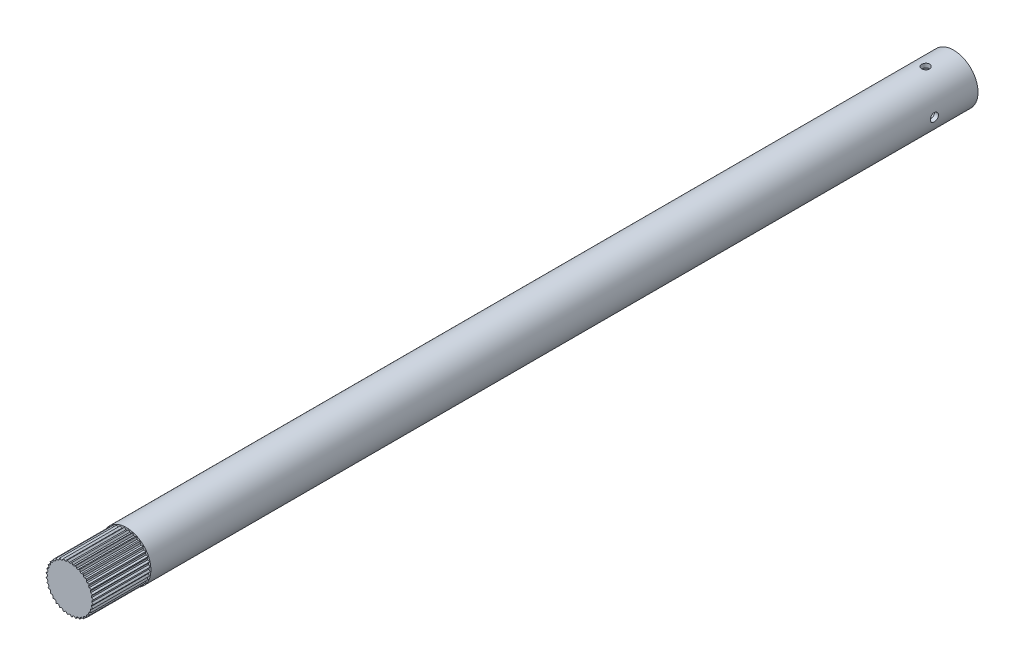
from build123d import *

# Parameters (mm, degrees)
SKETCH5_W               = 1.587499994
SKETCH5_H               = 345.340081988
CUT_EXTRUDE5_DEPTH      = 368.748370511
CUT_EXTRUDE5_DEPTH_BACK = 368.748370511
SKETCH7_R               = 1.5875
CUT_EXTRUDE6_DEPTH      = 368.748370616
CUT_EXTRUDE6_DEPTH_BACK = 368.748370616
SKETCH6_R               = 1.5875
CUT_EXTRUDE7_START      = 367.501582
SKETCH8_R               = 12.7
CUT_EXTRUDE7_DEPTH      = 22.225
SKETCH10_R              = 7.9375
BOSS_EXTRUDE1_DEPTH     = 319.940081988


with BuildPart() as part:
    # Sketch5 → Revolve2 (revolve)
    with BuildSketch(Plane(origin=(0, 0, 0), x_dir=(1, 0, 0), z_dir=(0, 1, 0)), mode=Mode.PRIVATE) as revolve2_sk:
        with Locations((8.731249997, -194.831540994)):
            Rectangle(SKETCH5_W, SKETCH5_H)
    revolve(revolve2_sk.sketch.rotate(Axis((0, 0, 0), (0, 0, 1)), 180), axis=Axis((0, 0, 0), (0, 0, 1)))

    # Sketch7 → Cut-Extrude5 (cut, two sides: drawn at the far end of the back side and taken through both)
    with BuildSketch(Plane(origin=(0, 0, 0), x_dir=(0, 0, -1), z_dir=(1, 0, 0)).offset(-CUT_EXTRUDE5_DEPTH_BACK)):
        with Locations((-39.195999993, 0)):
            Circle(SKETCH7_R)
    extrude(amount=CUT_EXTRUDE5_DEPTH + CUT_EXTRUDE5_DEPTH_BACK, mode=Mode.SUBTRACT)

    # Sketch6 → Cut-Extrude6 (cut, two sides: drawn at the far end of the back side and taken through both)
    with BuildSketch(Plane(origin=(0, 0, 0), x_dir=(1, 0, 0), z_dir=(0, 1, 0)).offset(-CUT_EXTRUDE6_DEPTH_BACK)):
        with Locations(Location((1e-09, -33.163499999, 0), (0, 0, 269.999999955))):
            Circle(SKETCH6_R)
    extrude(amount=CUT_EXTRUDE6_DEPTH + CUT_EXTRUDE6_DEPTH_BACK, mode=Mode.SUBTRACT)

    # Sketch8 → Cut-Extrude7 (cut)
    with BuildSketch(Plane.XY.offset(CUT_EXTRUDE7_START)):
        Circle(SKETCH8_R)
        Polygon((9.235721046, -0.808020891), (8.681700155, -0.254), (8.681700155, 0.254), (9.235721046, 0.808020891), (8.593912259, 1.257420242), (8.505698985, 1.75770258), (8.955098336, 2.399511367), (8.245002688, 2.730634406), (8.071256455, 3.207998257), (8.402379494, 3.918093905), (7.645572882, 4.120879625), (7.391572882, 4.56082053), (7.594358603, 5.317627141), (6.813836213, 5.385914002), (6.487300108, 5.775064579), (6.555586968, 6.555586968), (5.775064579, 6.487300108), (5.385914002, 6.813836213), (5.317627141, 7.594358603), (4.56082053, 7.391572882), (4.120879625, 7.645572882), (3.918093905, 8.402379494), (3.207998257, 8.071256455), (2.730634406, 8.245002688), (2.399511367, 8.955098336), (1.75770258, 8.505698985), (1.257420242, 8.593912259), (0.808020891, 9.235721046), (0.254, 8.681700155), (-0.254, 8.681700155), (-0.808020891, 9.235721046), (-1.257420242, 8.593912259), (-1.75770258, 8.505698985), (-2.399511367, 8.955098336), (-2.730634406, 8.245002688), (-3.207998257, 8.071256455), (-3.918093905, 8.402379494), (-4.120879625, 7.645572882), (-4.56082053, 7.391572882), (-5.317627141, 7.594358603), (-5.385914002, 6.813836213), (-5.775064579, 6.487300108), (-6.555586968, 6.555586968), (-6.487300108, 5.775064579), (-6.813836213, 5.385914002), (-7.594358603, 5.317627141), (-7.391572882, 4.56082053), (-7.645572882, 4.120879625), (-8.402379494, 3.918093905), (-8.071256455, 3.207998257), (-8.245002688, 2.730634406), (-8.955098336, 2.399511367), (-8.505698985, 1.75770258), (-8.593912259, 1.257420242), (-9.235721046, 0.808020891), (-8.681700155, 0.254), (-8.681700155, -0.254), (-9.235721046, -0.808020891), (-8.593912259, -1.257420242), (-8.505698985, -1.75770258), (-8.955098336, -2.399511367), (-8.245002688, -2.730634406), (-8.071256455, -3.207998257), (-8.402379494, -3.918093905), (-7.645572882, -4.120879625), (-7.391572882, -4.56082053), (-7.594358603, -5.317627141), (-6.813836213, -5.385914002), (-6.487300108, -5.775064579), (-6.555586968, -6.555586968), (-5.775064579, -6.487300108), (-5.385914002, -6.813836213), (-5.317627141, -7.594358603), (-4.56082053, -7.391572882), (-4.120879625, -7.645572882), (-3.918093905, -8.402379494), (-3.207998257, -8.071256455), (-2.730634406, -8.245002688), (-2.399511367, -8.955098336), (-1.75770258, -8.505698985), (-1.257420242, -8.593912259), (-0.808020891, -9.235721046), (-0.254, -8.681700155), (0.254, -8.681700155), (0.808020891, -9.235721046), (1.257420242, -8.593912259), (1.75770258, -8.505698985), (2.399511367, -8.955098336), (2.730634406, -8.245002688), (3.207998257, -8.071256455), (3.918093905, -8.402379494), (4.120879625, -7.645572882), (4.56082053, -7.391572882), (5.317627141, -7.594358603), (5.385914002, -6.813836213), (5.775064579, -6.487300108), (6.555586968, -6.555586968), (6.487300108, -5.775064579), (6.813836213, -5.385914002), (7.594358603, -5.317627141), (7.391572882, -4.56082053), (7.645572882, -4.120879625), (8.402379494, -3.918093905), (8.071256455, -3.207998257), (8.245002688, -2.730634406), (8.955098336, -2.399511367), (8.505698985, -1.75770258), (8.593912259, -1.257420242), align=None, mode=Mode.SUBTRACT)
    extrude(amount=-CUT_EXTRUDE7_DEPTH, mode=Mode.SUBTRACT)

    # Sketch10 → Boss-Extrude1 (add)
    with BuildSketch(Plane(origin=(0, 0, 47.5615), x_dir=(-1, 0, 0), z_dir=(0, 0, -1))):
        Circle(SKETCH10_R)
    extrude(amount=-BOSS_EXTRUDE1_DEPTH)


solid = part.part
